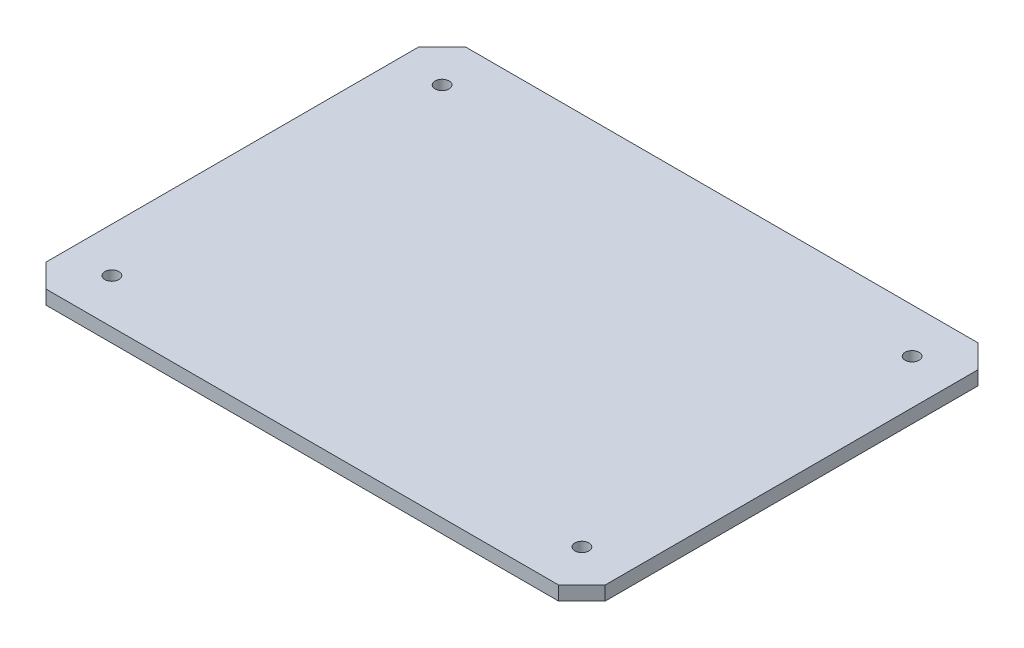
from build123d import *

# Parameters (mm, degrees)
SKETCH1_W                            = 120
SKETCH1_H                            = 90
BOSS_EXTRUDE1_DEPTH                  = 3
CHAMFER1_SIZE                        = 5
F_3_0_3_DIAMETER_HOLE2_D             = 3
MIRROR1_AT_THE_SECOND_PLANE_COPY_1_D = 3


with BuildPart() as part:
    # Sketch1 → Boss-Extrude1 (new body)
    with BuildSketch(Plane(origin=(0, 0, 0), x_dir=(1, 0, 0), z_dir=(0, 1, 0))):
        Rectangle(SKETCH1_W, SKETCH1_H)
    extrude(amount=BOSS_EXTRUDE1_DEPTH)

    # Chamfer1
    chamfer1_edges = [part.edges().sort_by_distance(p)[0] for p in [
        (60, 1.5, 45),
        (-60, 1.5, 45),
        (-60, 1.5, -45),
        (60, 1.5, -45),
    ]]
    chamfer(chamfer1_edges, length=CHAMFER1_SIZE)

    # Ø3.0 (3) Diameter Hole2 (through all)
    with Locations(Plane.XZ):
        with Locations((-50.428932188, 35.428932188)):
            f_3_0_3_diameter_hole2 = Hole(F_3_0_3_DIAMETER_HOLE2_D / 2)

    # Mirror1: Ø3.0 (3) Diameter Hole2 across plane
    add(f_3_0_3_diameter_hole2.mirror(Plane.XY), mode=Mode.SUBTRACT)

    # Mirror1 at the second plane: Ø3.0 (3) Diameter Hole2 across plane
    add(f_3_0_3_diameter_hole2.mirror(Plane(origin=(0, 0, 0), x_dir=(0, 0, 1), z_dir=(1, 0, 0))), mode=Mode.SUBTRACT)

    # Mirror1 at the second plane copy 1 (through all)
    with Locations(Plane(origin=(0, 0, 0), x_dir=(-1, 0, 0), z_dir=(0, -1, 0))):
        with Locations((-50.428932188, 35.428932188)):
            Hole(MIRROR1_AT_THE_SECOND_PLANE_COPY_1_D / 2)


solid = part.part
